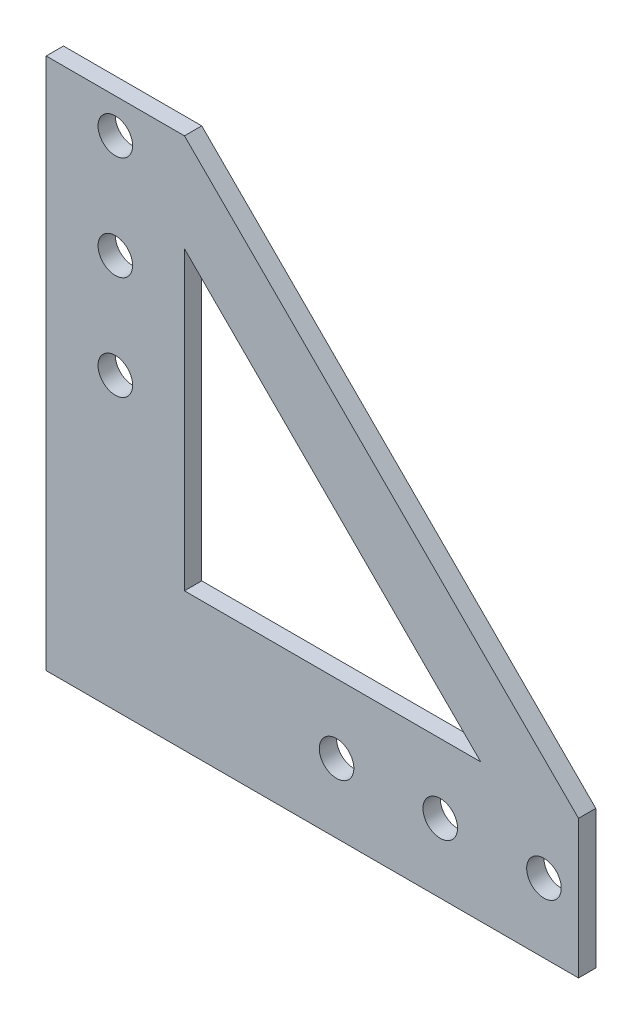
from build123d import *

# Parameters (mm, degrees)
BOSS_EXTRUDE1_DEPTH = 3.175
SKETCH2_R           = 3.175
CUT_EXTRUDE1_DEPTH  = 139.332385308


with BuildPart() as part:
    # Sketch1 → Boss-Extrude1 (new body)
    with BuildSketch(Plane.XY):
        Polygon((25.4, 97.79), (97.79, 25.4), (97.79, 0), (0, 0), (0, 97.79), align=None)
        Polygon((25.4, 25.4), (25.4, 79.829487758), (79.829487758, 25.4), align=None, mode=Mode.SUBTRACT)
    extrude(amount=BOSS_EXTRUDE1_DEPTH)

    # Sketch2 → Cut-Extrude1 (cut, through all)
    with BuildSketch(Plane.XY.offset(3.175)):
        with Locations((53.34, 12.7)):
            Circle(SKETCH2_R)
        with Locations((72.39, 12.7)):
            Circle(SKETCH2_R)
        with Locations((12.7, 53.34)):
            Circle(SKETCH2_R)
        with Locations((12.7, 72.39)):
            Circle(SKETCH2_R)
        with Locations((12.7, 91.44)):
            Circle(SKETCH2_R)
        with Locations((91.44, 12.7)):
            Circle(SKETCH2_R)
    extrude(amount=-CUT_EXTRUDE1_DEPTH, mode=Mode.SUBTRACT)


solid = part.part
